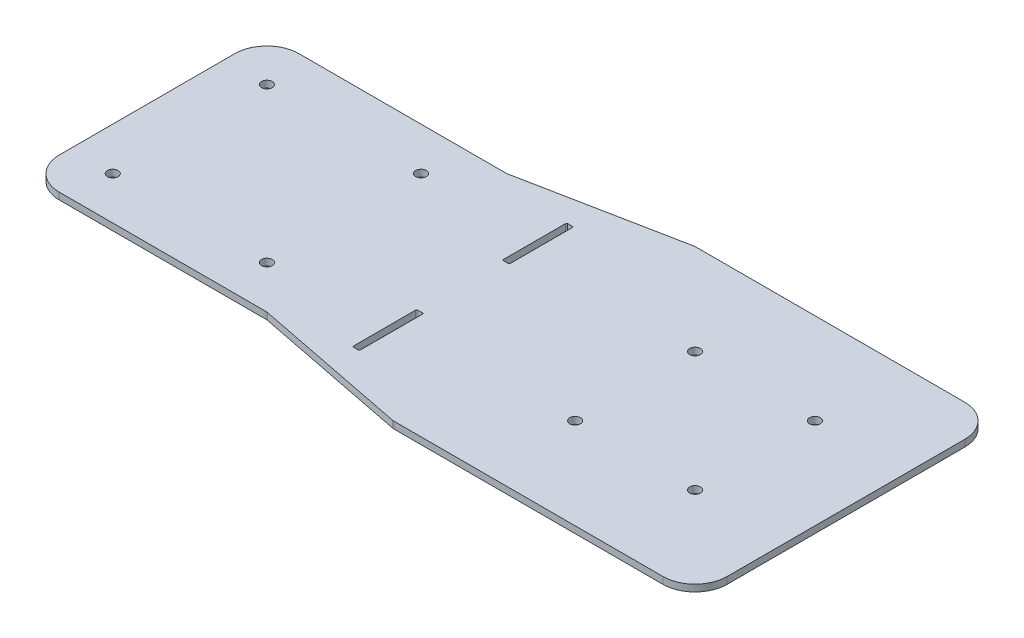
from build123d import *

# Parameters (mm, degrees)
BOSS_EXTRUDE1_DEPTH = 3.175
SKETCH5_R           = 2.5
CUT_EXTRUDE2_DEPTH  = 280.554253455
CUT_EXTRUDE3_DEPTH  = 280.554253455
FILLET1_R           = 15
FILLET2_R           = 5
SKETCH7_R           = 2.5
CUT_EXTRUDE4_DEPTH  = 280.554253455


with BuildPart() as part:
    # Sketch1 → Boss-Extrude1 (new body)
    with BuildSketch(Plane(origin=(0, 0, 0), x_dir=(1, 0, 0), z_dir=(0, 1, 0))):
        Polygon((56, 56), (129.5, 70.5), (270.5, 70.5), (270.5, -70.5), (129.5, -70.5), (56, -56), (-56, -56), (-56, 56), align=None)
    extrude(amount=BOSS_EXTRUDE1_DEPTH)

    # Sketch5 → Cut-Extrude2 (cut, through all)
    with BuildSketch(Plane(origin=(0, 3.175, 0), x_dir=(1, 0, 0), z_dir=(0, 1, 0))):
        with Locations(Location((172, 28, 0), (0, 0, 270))):
            Circle(SKETCH5_R)
        with Locations(Location((228, 28, 0), (0, 0, 90))):
            Circle(SKETCH5_R)
        with Locations(Location((228, -28, 0), (0, 0, 270))):
            Circle(SKETCH5_R)
        with Locations(Location((172, -28, 0), (0, 0, 90))):
            Circle(SKETCH5_R)
    extrude(amount=-CUT_EXTRUDE2_DEPTH, mode=Mode.SUBTRACT)

    # Sketch6 → Cut-Extrude3 (cut, through all)
    with BuildSketch(Plane(origin=(0, 3.175, 0), x_dir=(1, 0, 0), z_dir=(0, 1, 0))):
        with BuildLine():
            Line((93.2, 20.5), (93.2, 49.5))
            ThreePointArc((93.2, 49.5), (93.053553391, 49.853553391), (92.7, 50))
            Line((92.7, 50), (90.5, 50))
            ThreePointArc((90.5, 50), (90.146446609, 49.853553391), (90, 49.5))
            Line((90, 49.5), (90, 20.5))
            ThreePointArc((90, 20.5), (90.146446609, 20.146446609), (90.5, 20))
            Line((90.5, 20), (92.7, 20))
            ThreePointArc((92.7, 20), (93.053553391, 20.146446609), (93.2, 20.5))
        make_face()
        with BuildLine():
            Line((90.5, -20), (92.7, -20))
            ThreePointArc((92.7, -20), (93.053553391, -20.146446609), (93.2, -20.5))
            Line((93.2, -20.5), (93.2, -49.5))
            ThreePointArc((93.2, -49.5), (93.053553391, -49.853553391), (92.7, -50))
            Line((92.7, -50), (90.5, -50))
            ThreePointArc((90.5, -50), (90.146446609, -49.853553391), (90, -49.5))
            Line((90, -49.5), (90, -20.5))
            ThreePointArc((90, -20.5), (90.146446609, -20.146446609), (90.5, -20))
        make_face()
    extrude(amount=-CUT_EXTRUDE3_DEPTH, mode=Mode.SUBTRACT)

    # Fillet1
    fillet1_edges = [part.edges().sort_by_distance(p)[0] for p in [
        (270.5, 1.5875, 70.5),
        (-56, 1.5875, 56),
        (-56, 1.5875, -56),
        (270.5, 1.5875, -70.5),
    ]]
    fillet(fillet1_edges, radius=FILLET1_R)

    # Fillet2
    fillet2_edges = [part.edges().sort_by_distance(p)[0] for p in [
        (129.5, 1.5875, 70.5),
        (56, 1.5875, 56),
        (56, 1.5875, -56),
        (129.5, 1.5875, -70.5),
    ]]
    fillet(fillet2_edges, radius=FILLET2_R)

    # Sketch7 → Cut-Extrude4 (cut, through all)
    with BuildSketch(Plane(origin=(0, 3.175, 0), x_dir=(1, 0, 0), z_dir=(0, 1, 0))):
        with Locations(Location((-36, 36, 0), (0, 0, 270))):
            Circle(SKETCH7_R)
        with Locations(Location((36, 36, 0), (0, 0, 90))):
            Circle(SKETCH7_R)
        with Locations(Location((-36, -36, 0), (0, 0, 90))):
            Circle(SKETCH7_R)
        with Locations(Location((36, -36, 0), (0, 0, 270))):
            Circle(SKETCH7_R)
    extrude(amount=-CUT_EXTRUDE4_DEPTH, mode=Mode.SUBTRACT)


solid = part.part
